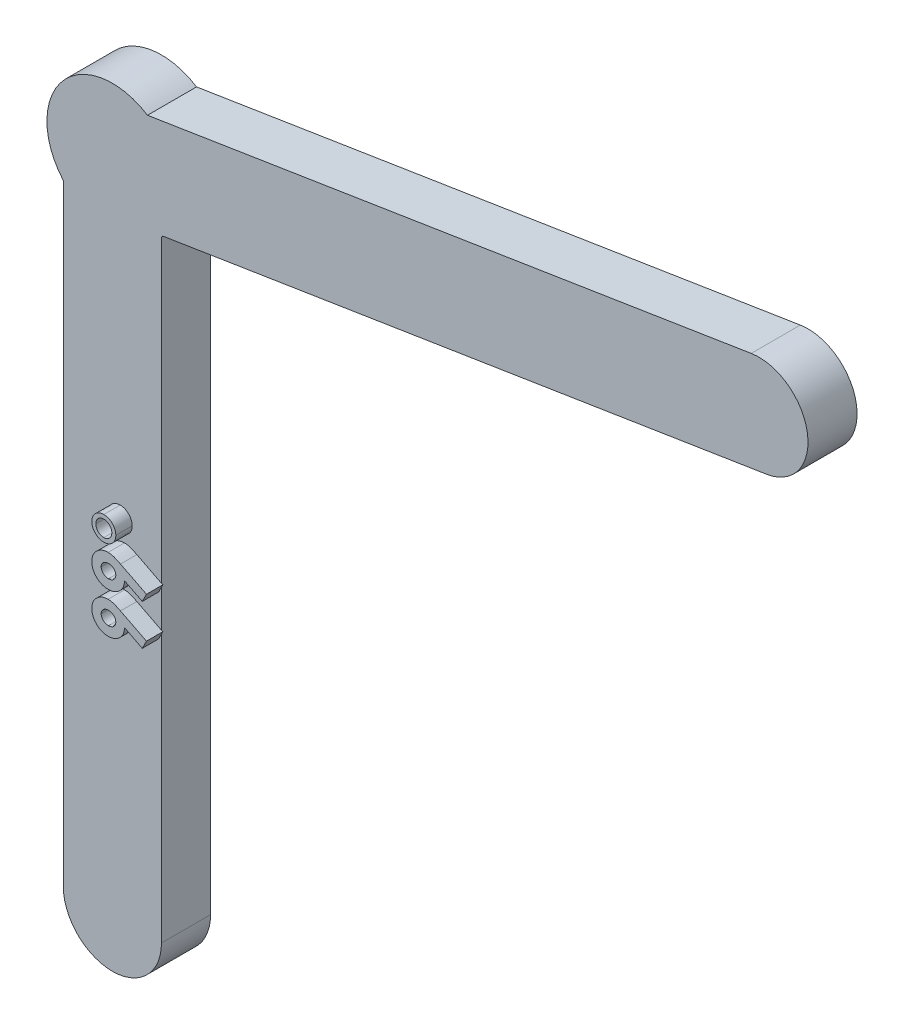
from build123d import *

# Parameters (mm, degrees)
BOSS_EXTRUDE1_DEPTH = 3
BOSS_EXTRUDE2_DEPTH = 1


with BuildPart() as part:
    # Sketch2 → Boss-Extrude1 (new body)
    with BuildSketch(Plane.XY):
        with BuildLine():
            Line((-3, -40), (-3, -2.645751311))
            ThreePointArc((-3, -2.645751311), (-3.041623862, 2.597792193), (2.143874327, 3.376951713))
            Line((2.143874327, 3.376951713), (39.038230229, 9.220443623))
            ThreePointArc((39.038230229, 9.220443623), (42.470598646, 6.726681997), (39.976837019, 3.29431358))
            Line((39.976837019, 3.29431358), (3.082481117, -2.549178331))
            ThreePointArc((3.082481117, -2.549178331), (3.041623862, -2.597792193), (3, -2.645751311))
            Line((3, -2.645751311), (3, -40))
            ThreePointArc((3, -40), (0, -43), (-3, -40))
        make_face()
    extrude(amount=BOSS_EXTRUDE1_DEPTH)

    # Sketch3 → Boss-Extrude2 (add)
    # profile 1 of 3: a face of its own
    with BuildSketch(Plane.XY.offset(3)):
        with BuildLine():
            Line((3.081410256, -23.487879662), (2.827003205, -23.992877659))
            Line((2.827003205, -23.992877659), (1.738141026, -23.439542322))
            add(Edge.make_bspline(
                [(1.738141026, -23.439542322), (1.737307679, -23.472234594), (1.735671617, -23.536417434), (1.722077887, -23.630922515), (1.698867665, -23.721292128), (1.66798568, -23.808607175), (1.626522834, -23.891601705), (1.577200392, -23.971615874), (1.517036085, -24.046560451), (1.450419163, -24.118230318), (1.376587483, -24.183061203), (1.297699676, -24.240317721), (1.214515018, -24.288800276), (1.126474523, -24.327720032), (1.034455588, -24.358287774), (0.938097245, -24.380833149), (0.837028859, -24.393447012), (0.768247832, -24.39521354), (0.733233173, -24.396112835)],
                knots=[0, 0, 0, 0, 1.014438208, 1.991587644, 2.955575466, 3.906834206, 4.860343588, 5.829907848, 6.818577787, 7.838125475, 8.863876483, 9.862937823, 10.859547262, 11.846397878, 12.845242478, 13.865236027, 14.913246352, 16, 16, 16, 16], degree=3))
            add(Edge.make_bspline(
                [(0.733233173, -24.396112835), (0.699268433, -24.395280382), (0.632341616, -24.393640051), (0.534122537, -24.379990026), (0.439788191, -24.357592337), (0.349312599, -24.326568606), (0.263156461, -24.286168698), (0.180806411, -24.237357876), (0.102577428, -24.179409039), (0.029488987, -24.112797961), (-0.037683266, -24.04062606), (-0.095496052, -23.962982149), (-0.145955203, -23.882853555), (-0.185821936, -23.798036147), (-0.218223882, -23.710105693), (-0.240134192, -23.617853045), (-0.253941767, -23.52222072), (-0.255580842, -23.45718675), (-0.256410256, -23.424277899)],
                knots=[0, 0, 0, 0, 1.055350394, 2.079546115, 3.075301024, 4.065173222, 5.046874257, 6.027823047, 7.036058964, 8.067100199, 9.097720188, 10.095392023, 11.071904115, 12.035727154, 13.002945728, 13.979480054, 14.977565287, 16, 16, 16, 16], degree=3))
            add(Edge.make_bspline(
                [(-0.256410256, -23.424277899), (-0.25570183, -23.38987558), (-0.254308805, -23.322228075), (-0.238947683, -23.223198042), (-0.215359574, -23.128462296), (-0.183397712, -23.037578481), (-0.139790653, -22.951988361), (-0.088562765, -22.87006109), (-0.026527751, -22.79338446), (0.04326259, -22.721565352), (0.119819456, -22.656909611), (0.199293738, -22.599265361), (0.281930305, -22.550265896), (0.367786702, -22.511125223), (0.456273003, -22.480003135), (0.547584954, -22.458797255), (0.641632797, -22.444681565), (0.705408393, -22.443078164), (0.737685296, -22.442266681)],
                knots=[0, 0, 0, 0, 1.062709067, 2.08967359, 3.089490552, 4.078335371, 5.060205664, 6.052952122, 7.060109841, 8.102908433, 9.144326257, 10.153805576, 11.135063239, 12.108674621, 13.066249871, 14.029571809, 15.002763993, 16, 16, 16, 16], degree=3))
            add(Edge.make_bspline(
                [(0.737685296, -22.442266681), (0.762301574, -22.442712361), (0.81188429, -22.443610061), (0.886036554, -22.452326744), (0.960379342, -22.465733885), (1.022999032, -22.481369597), (1.075997682, -22.497097067), (1.120830704, -22.513451007), (1.170788936, -22.533174625), (1.22594926, -22.556003588), (1.286038418, -22.582121309), (1.350847586, -22.612418046), (1.421369847, -22.644980243), (1.469590593, -22.668985744), (1.494546274, -22.681409309)],
                knots=[0, 0, 0, 0, 1.105166677, 2.22605417, 3.348517788, 4.496260522, 5.122810462, 5.830557215, 6.638607343, 7.535109037, 8.511576286, 9.580928918, 10.748058253, 12, 12, 12, 12], degree=3))
            Line((1.494546274, -22.681409309), (3.081410256, -23.487879662))
        make_face()
        with BuildLine():
            add(Edge.make_bspline(
                [(1.208974359, -23.411557547), (1.207369342, -23.384249387), (1.204233503, -23.330895428), (1.179911618, -23.254294637), (1.138417283, -23.185464843), (1.082521415, -23.125088989), (1.015324017, -23.074828673), (0.938975473, -23.038000561), (0.854691699, -23.015672489), (0.795913949, -23.013339108), (0.765670072, -23.012138476)],
                knots=[0, 0, 0, 0, 0.984989413, 1.924446292, 2.868477643, 3.865502828, 4.877610339, 5.88087679, 6.909612885, 8, 8, 8, 8], degree=3))
            add(Edge.make_bspline(
                [(0.765670072, -23.012138476), (0.734793399, -23.013574139), (0.674730896, -23.016366847), (0.588284104, -23.039079097), (0.510141331, -23.077889764), (0.442213741, -23.130689457), (0.385367027, -23.19233241), (0.343842032, -23.261264791), (0.318164307, -23.335812779), (0.315039952, -23.387402594), (0.313461538, -23.413465599)],
                knots=[0, 0, 0, 0, 1.104110315, 2.147758178, 3.172670271, 4.206310416, 5.210906102, 6.157051016, 7.068948237, 8, 8, 8, 8], degree=3))
            add(Edge.make_bspline(
                [(0.313461538, -23.413465599), (0.315003347, -23.441009826), (0.318030676, -23.49509269), (0.343602738, -23.57271934), (0.384431439, -23.643954827), (0.44077104, -23.707106229), (0.508416133, -23.76049381), (0.586808982, -23.798455172), (0.672697468, -23.822248675), (0.732861373, -23.824886323), (0.763762019, -23.82624104)],
                knots=[0, 0, 0, 0, 0.970853505, 1.906262912, 2.855477211, 3.852937491, 4.877462982, 5.878766514, 6.910518104, 8, 8, 8, 8], degree=3))
            add(Edge.make_bspline(
                [(0.763762019, -23.82624104), (0.794228566, -23.824833745), (0.853482819, -23.822096704), (0.938337992, -23.799042725), (1.0154379, -23.761844204), (1.082728129, -23.709958468), (1.138908417, -23.647562709), (1.179920426, -23.57563959), (1.204301458, -23.49577751), (1.207388686, -23.440136219), (1.208974359, -23.411557547)],
                knots=[0, 0, 0, 0, 1.075841396, 2.092399178, 3.084869331, 4.085011737, 5.078048045, 6.03490933, 6.990683323, 8, 8, 8, 8], degree=3))
        make_face(mode=Mode.SUBTRACT)
    # profile 2 of 3: a face of its own
    with BuildSketch(Plane.XY.offset(3)):
        with BuildLine():
            Line((3.081410256, -21.004866841), (2.827003205, -21.509864838))
            Line((2.827003205, -21.509864838), (1.738141026, -20.956529502))
            add(Edge.make_bspline(
                [(1.738141026, -20.956529502), (1.737307679, -20.989221774), (1.735671617, -21.053404613), (1.722077887, -21.147909694), (1.698867665, -21.238279307), (1.66798568, -21.325594354), (1.626522834, -21.408588884), (1.577200392, -21.488603054), (1.517036085, -21.563547631), (1.450419163, -21.635217497), (1.376587483, -21.700048383), (1.297699676, -21.757304901), (1.214515018, -21.805787455), (1.126474523, -21.844707211), (1.034455588, -21.875274953), (0.938097245, -21.897820328), (0.837028859, -21.910434191), (0.768247832, -21.91220072), (0.733233173, -21.913100015)],
                knots=[0, 0, 0, 0, 1.014438208, 1.991587644, 2.955575466, 3.906834206, 4.860343588, 5.829907848, 6.818577787, 7.838125475, 8.863876483, 9.862937823, 10.859547262, 11.846397878, 12.845242478, 13.865236027, 14.913246352, 16, 16, 16, 16], degree=3))
            add(Edge.make_bspline(
                [(0.733233173, -21.913100015), (0.699268433, -21.912267562), (0.632341616, -21.91062723), (0.534122537, -21.896977206), (0.439788191, -21.874579517), (0.349312599, -21.843555785), (0.263156461, -21.803155877), (0.180806411, -21.754345055), (0.102577428, -21.696396219), (0.029488987, -21.62978514), (-0.037683266, -21.557613239), (-0.095496052, -21.479969328), (-0.145955203, -21.399840734), (-0.185821936, -21.315023326), (-0.218223882, -21.227092872), (-0.240134192, -21.134840225), (-0.253941767, -21.039207899), (-0.255580842, -20.974173929), (-0.256410256, -20.941265079)],
                knots=[0, 0, 0, 0, 1.055350394, 2.079546115, 3.075301024, 4.065173222, 5.046874257, 6.027823047, 7.036058964, 8.067100199, 9.097720188, 10.095392023, 11.071904115, 12.035727154, 13.002945728, 13.979480054, 14.977565287, 16, 16, 16, 16], degree=3))
            add(Edge.make_bspline(
                [(-0.256410256, -20.941265079), (-0.25570183, -20.90686276), (-0.254308805, -20.839215254), (-0.238947683, -20.740185221), (-0.215359574, -20.645449475), (-0.183397712, -20.554565661), (-0.139790653, -20.468975541), (-0.088562765, -20.387048269), (-0.026527751, -20.31037164), (0.04326259, -20.238552531), (0.119819456, -20.173896791), (0.199293738, -20.11625254), (0.281930305, -20.067253075), (0.367786702, -20.028112403), (0.456273003, -19.996990314), (0.547584954, -19.975784434), (0.641632797, -19.961668745), (0.705408393, -19.960065344), (0.737685296, -19.959253861)],
                knots=[0, 0, 0, 0, 1.062709067, 2.08967359, 3.089490552, 4.078335371, 5.060205664, 6.052952122, 7.060109841, 8.102908433, 9.144326257, 10.153805576, 11.135063239, 12.108674621, 13.066249871, 14.029571809, 15.002763993, 16, 16, 16, 16], degree=3))
            add(Edge.make_bspline(
                [(0.737685296, -19.959253861), (0.762301574, -19.959699541), (0.81188429, -19.96059724), (0.886036554, -19.969313923), (0.960379342, -19.982721064), (1.022999032, -19.998356776), (1.075997682, -20.014084247), (1.120830704, -20.030438187), (1.170788936, -20.050161804), (1.22594926, -20.072990767), (1.286038418, -20.099108489), (1.350847586, -20.129405225), (1.421369847, -20.161967423), (1.469590593, -20.185972923), (1.494546274, -20.198396489)],
                knots=[0, 0, 0, 0, 1.105166677, 2.22605417, 3.348517788, 4.496260522, 5.122810462, 5.830557215, 6.638607343, 7.535109037, 8.511576286, 9.580928918, 10.748058253, 12, 12, 12, 12], degree=3))
            Line((1.494546274, -20.198396489), (3.081410256, -21.004866841))
        make_face()
        with BuildLine():
            add(Edge.make_bspline(
                [(1.208974359, -20.928544726), (1.207369342, -20.901236567), (1.204233503, -20.847882607), (1.179911618, -20.771281817), (1.138417283, -20.702452023), (1.082521415, -20.642076168), (1.015324017, -20.591815853), (0.938975473, -20.55498774), (0.854691699, -20.532659668), (0.795913949, -20.530326288), (0.765670072, -20.529125656)],
                knots=[0, 0, 0, 0, 0.984989413, 1.924446292, 2.868477643, 3.865502828, 4.877610339, 5.88087679, 6.909612885, 8, 8, 8, 8], degree=3))
            add(Edge.make_bspline(
                [(0.765670072, -20.529125656), (0.734793399, -20.530561319), (0.674730896, -20.533354026), (0.588284104, -20.556066277), (0.510141331, -20.594876944), (0.442213741, -20.647676637), (0.385367027, -20.70931959), (0.343842032, -20.778251971), (0.318164307, -20.852799958), (0.315039952, -20.904389774), (0.313461538, -20.930452779)],
                knots=[0, 0, 0, 0, 1.104110315, 2.147758178, 3.172670271, 4.206310416, 5.210906102, 6.157051016, 7.068948237, 8, 8, 8, 8], degree=3))
            add(Edge.make_bspline(
                [(0.313461538, -20.930452779), (0.315003347, -20.957997006), (0.318030676, -21.012079869), (0.343602738, -21.089706519), (0.384431439, -21.160942006), (0.44077104, -21.224093409), (0.508416133, -21.27748099), (0.586808982, -21.315442351), (0.672697468, -21.339235854), (0.732861373, -21.341873503), (0.763762019, -21.34322822)],
                knots=[0, 0, 0, 0, 0.970853505, 1.906262912, 2.855477211, 3.852937491, 4.877462982, 5.878766514, 6.910518104, 8, 8, 8, 8], degree=3))
            add(Edge.make_bspline(
                [(0.763762019, -21.34322822), (0.794228566, -21.341820925), (0.853482819, -21.339083883), (0.938337992, -21.316029904), (1.0154379, -21.278831383), (1.082728129, -21.226945647), (1.138908417, -21.164549889), (1.179920426, -21.09262677), (1.204301458, -21.01276469), (1.207388686, -20.957123399), (1.208974359, -20.928544726)],
                knots=[0, 0, 0, 0, 1.075841396, 2.092399178, 3.084869331, 4.085011737, 5.078048045, 6.03490933, 6.990683323, 8, 8, 8, 8], degree=3))
        make_face(mode=Mode.SUBTRACT)
    # profile 3 of 3: a face of its own
    with BuildSketch(Plane.XY.offset(3)):
        with BuildLine():
            add(Edge.make_bspline(
                [(0.476282051, -18.086817963), (0.501543872, -18.087364458), (0.55122174, -18.08843915), (0.624352745, -18.09887245), (0.694208258, -18.116351665), (0.761803607, -18.138762312), (0.825395964, -18.169901063), (0.886396731, -18.206762812), (0.943669883, -18.251261647), (0.9978957, -18.300873943), (1.047295391, -18.355374106), (1.090947065, -18.413264463), (1.127096601, -18.474723442), (1.157366856, -18.538436223), (1.180332148, -18.605267637), (1.196689885, -18.674723561), (1.20741609, -18.747095961), (1.208449037, -18.796362846), (1.208974359, -18.821418324)],
                knots=[0, 0, 0, 0, 1.048753193, 2.062393874, 3.059725798, 4.03711221, 5.013824111, 5.993903926, 6.992478922, 8.020738441, 9.043061753, 10.043343452, 11.026424807, 11.999358773, 12.968420071, 13.955122655, 14.960044262, 16, 16, 16, 16], degree=3))
            add(Edge.make_bspline(
                [(1.208974359, -18.821418324), (1.208454225, -18.846475657), (1.207431478, -18.895746188), (1.196631189, -18.968092103), (1.180530583, -19.037714118), (1.156529218, -19.104250665), (1.126678292, -19.168015505), (1.090260147, -19.228931791), (1.046482503, -19.286459968), (0.996781055, -19.340441772), (0.942375086, -19.389966612), (0.88420218, -19.433341886), (0.823225465, -19.470805091), (0.758107997, -19.499696411), (0.69067286, -19.523806013), (0.619758864, -19.539846814), (0.545943315, -19.55069208), (0.495615647, -19.551692059), (0.469921875, -19.552202579)],
                knots=[0, 0, 0, 0, 1.037227242, 2.039512271, 3.023626077, 3.993053151, 4.963434463, 5.936395473, 6.927031705, 7.952593414, 8.972234493, 9.969891786, 10.954906455, 11.929570282, 12.915563215, 13.916770353, 14.936449251, 16, 16, 16, 16], degree=3))
            add(Edge.make_bspline(
                [(0.469921875, -19.552202579), (0.445290866, -19.551670426), (0.396869022, -19.550624272), (0.325492116, -19.539962635), (0.256787066, -19.523041749), (0.190979117, -19.498674204), (0.128167681, -19.467589222), (0.067236284, -19.43103911), (0.010175979, -19.385796386), (-0.044275745, -19.335374696), (-0.093962638, -19.280077483), (-0.137555056, -19.221381354), (-0.173973759, -19.159880994), (-0.203993097, -19.095993397), (-0.227847104, -19.029627537), (-0.244158222, -18.960270194), (-0.254789074, -18.888530507), (-0.255866772, -18.839688986), (-0.256410256, -18.815058148)],
                knots=[0, 0, 0, 0, 1.027628768, 2.020204677, 3.0054932, 3.977172113, 4.942988595, 5.928118098, 6.937247537, 7.976812879, 9.023474825, 10.036014018, 11.024160528, 12.002107364, 12.979092523, 13.962271943, 14.972371232, 16, 16, 16, 16], degree=3))
            add(Edge.make_bspline(
                [(-0.256410256, -18.815058148), (-0.255881051, -18.790425147), (-0.254836181, -18.741789382), (-0.244068832, -18.670286121), (-0.227959354, -18.601299478), (-0.203981879, -18.535383204), (-0.173948227, -18.472144091), (-0.137706982, -18.411360307), (-0.093944483, -18.353800823), (-0.043999627, -18.299878239), (0.009956511, -18.249646156), (0.068273488, -18.206486566), (0.128824771, -18.168963648), (0.192846684, -18.139314038), (0.259342082, -18.115253869), (0.329176204, -18.099092952), (0.401748506, -18.08840253), (0.451226198, -18.087350645), (0.476282051, -18.086817963)],
                knots=[0, 0, 0, 0, 1.02774298, 2.029191086, 3.012479778, 3.981238486, 4.951290381, 5.931946007, 6.930416638, 7.964088953, 8.997761269, 10.003308488, 10.98854748, 11.966603007, 12.943696749, 13.935593372, 14.954569896, 16, 16, 16, 16], degree=3))
        make_face()
        with BuildLine():
            add(Edge.make_bspline(
                [(0.479462139, -18.331048732), (0.462471258, -18.331283238), (0.428972226, -18.331745586), (0.379883793, -18.339364952), (0.332524379, -18.349882749), (0.287283463, -18.365142894), (0.24427911, -18.385093258), (0.203398935, -18.409430803), (0.164484674, -18.438033873), (0.128492582, -18.471096498), (0.095853701, -18.506962821), (0.066652511, -18.544756225), (0.042455186, -18.584945496), (0.023016589, -18.627132068), (0.006315159, -18.670660832), (-0.003707976, -18.716570899), (-0.01154919, -18.764122272), (-0.011966436, -18.796577872), (-0.012179487, -18.813150095)],
                knots=[0, 0, 0, 0, 1.061159961, 2.092171217, 3.098605391, 4.092036902, 5.070589041, 6.057187883, 7.061962211, 8.084674938, 9.107387665, 10.090954379, 11.06617917, 12.032717429, 12.99305519, 13.973669989, 14.965331307, 16, 16, 16, 16], degree=3))
            add(Edge.make_bspline(
                [(-0.012179487, -18.813150095), (-0.01157068, -18.829910386), (-0.01036426, -18.86312277), (-0.004409395, -18.912059806), (0.007572839, -18.958712685), (0.022606002, -19.003913936), (0.043122897, -19.046757116), (0.067542797, -19.08825021), (0.096744971, -19.127294336), (0.129769422, -19.164073639), (0.165718261, -19.197819438), (0.204573602, -19.22680952), (0.244977971, -19.252211383), (0.287582445, -19.272314335), (0.331832846, -19.288426708), (0.377821945, -19.300068401), (0.425871214, -19.306215297), (0.458458137, -19.307380147), (0.475010016, -19.307971809)],
                knots=[0, 0, 0, 0, 1.042034071, 2.064906527, 3.055369705, 4.030203466, 5.020228521, 6.000742353, 7.017744738, 8.043920206, 9.069249762, 10.075703201, 11.051782302, 12.029903876, 12.99669358, 13.974371501, 14.971122288, 16, 16, 16, 16], degree=3))
            add(Edge.make_bspline(
                [(0.475010016, -19.307971809), (0.491349767, -19.30737912), (0.523514051, -19.306212429), (0.570936909, -19.300082136), (0.616468237, -19.288324813), (0.660506807, -19.272284373), (0.703332854, -19.252317358), (0.743356347, -19.226088234), (0.782721478, -19.196878155), (0.819574977, -19.162797297), (0.853594861, -19.125917693), (0.883277913, -19.086422175), (0.908722399, -19.045481377), (0.929101491, -19.00249532), (0.945194342, -18.958232728), (0.956841315, -18.912246927), (0.962986781, -18.864196764), (0.964151827, -18.831609964), (0.96474359, -18.815058148)],
                knots=[0, 0, 0, 0, 1.017878107, 2.003660885, 2.970612419, 3.939454555, 4.919652619, 5.904816436, 6.913406512, 7.969270601, 9.02513469, 10.033724766, 11.041277553, 12.021475617, 12.990317753, 13.970071221, 14.968938047, 16, 16, 16, 16], degree=3))
            add(Edge.make_bspline(
                [(0.96474359, -18.815058148), (0.964515736, -18.798699662), (0.964066668, -18.766459342), (0.956359019, -18.719307863), (0.946146284, -18.673648262), (0.929505189, -18.630344626), (0.910263551, -18.587892872), (0.884925795, -18.548111468), (0.856415485, -18.509255279), (0.822504018, -18.473928631), (0.787116244, -18.439811813), (0.747777121, -18.411624529), (0.707718654, -18.386379122), (0.665616684, -18.365729034), (0.621397497, -18.350921575), (0.575848465, -18.338798455), (0.528165265, -18.33286842), (0.49579822, -18.331659095), (0.479462139, -18.331048732)],
                knots=[0, 0, 0, 0, 1.029744634, 2.029484694, 3.00508751, 3.97324883, 4.947661161, 5.937798898, 6.940036528, 7.980134083, 9.020231638, 10.033191535, 11.023329272, 12.003497406, 12.979740652, 13.958541426, 14.969648588, 16, 16, 16, 16], degree=3))
        make_face(mode=Mode.SUBTRACT)
    extrude(amount=BOSS_EXTRUDE2_DEPTH)


solid = part.part
